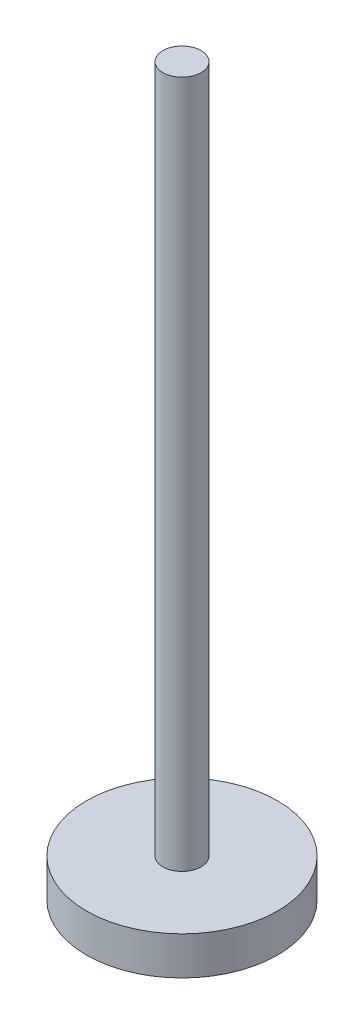
from build123d import *


with BuildPart() as part:
    # Sketch1 → Revolve1 (revolve)
    with BuildSketch(Plane.XY):
        Polygon((1.5, 19), (1, 19), (1, 0), (3.5, 0), (3.5, 1), (1.5, 1), align=None)
    revolve(axis=Axis((1, 19, 0), (0, -1, 0)))


solid = part.part
